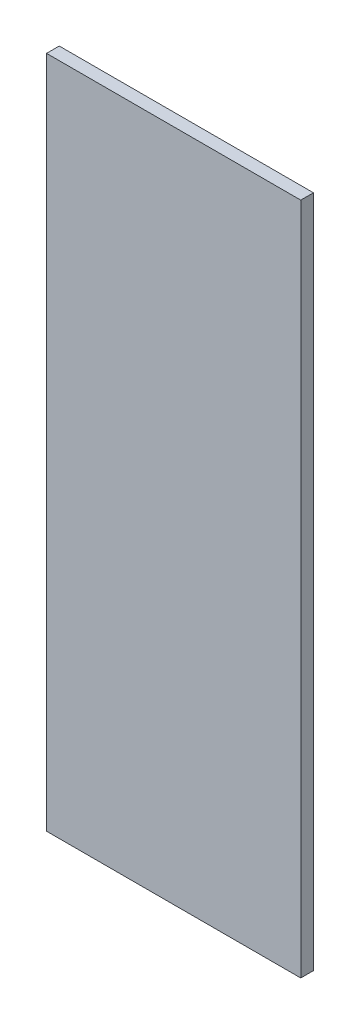
from build123d import *

# Parameters (mm, degrees)
CROQUIS1_W              = 80
CROQUIS1_H              = 212
SALIENTE_EXTRUIR1_DEPTH = 4


with BuildPart() as part:
    # Croquis1 → Saliente-Extruir1 (new body)
    with BuildSketch(Plane.XY):
        with Locations((40, 106)):
            Rectangle(CROQUIS1_W, CROQUIS1_H)
    extrude(amount=SALIENTE_EXTRUIR1_DEPTH)


solid = part.part
